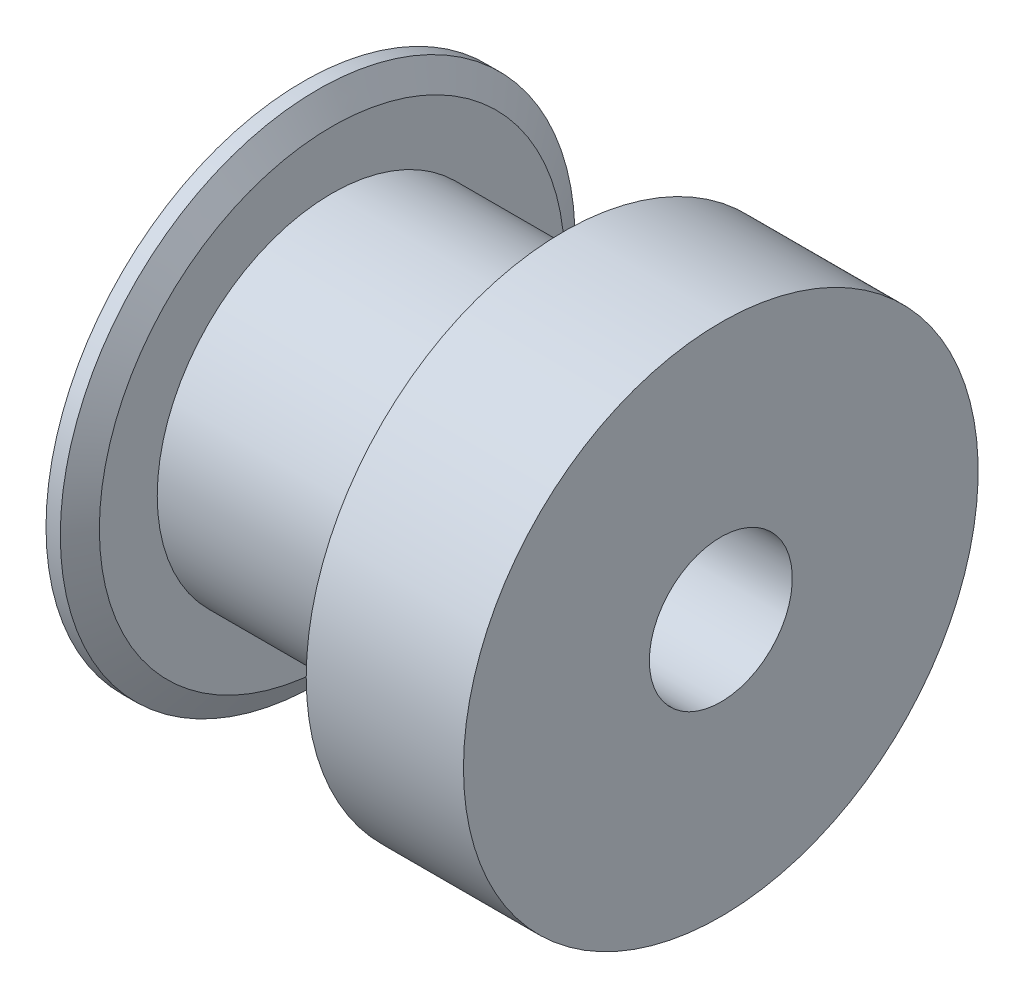
from build123d import *


with BuildPart() as part:
    # Schizzo1 → Rivoluzione1 (revolve)
    with BuildSketch(Plane.XY, mode=Mode.PRIVATE) as rivoluzione1_sk:
        Polygon((0, 9), (0.5, 9), (1, 8.133974596), (1, 6.11), (8.6, 6.11), (8.6, 8.133974596), (9.1, 9), (14.6, 9), (14.6, 2.5), (0, 2.5), align=None)
    revolve(rivoluzione1_sk.sketch.rotate(Axis((0, 0, 0), (1, 0, 0)), 90), axis=Axis((0, 0, 0), (1, 0, 0)))


solid = part.part
